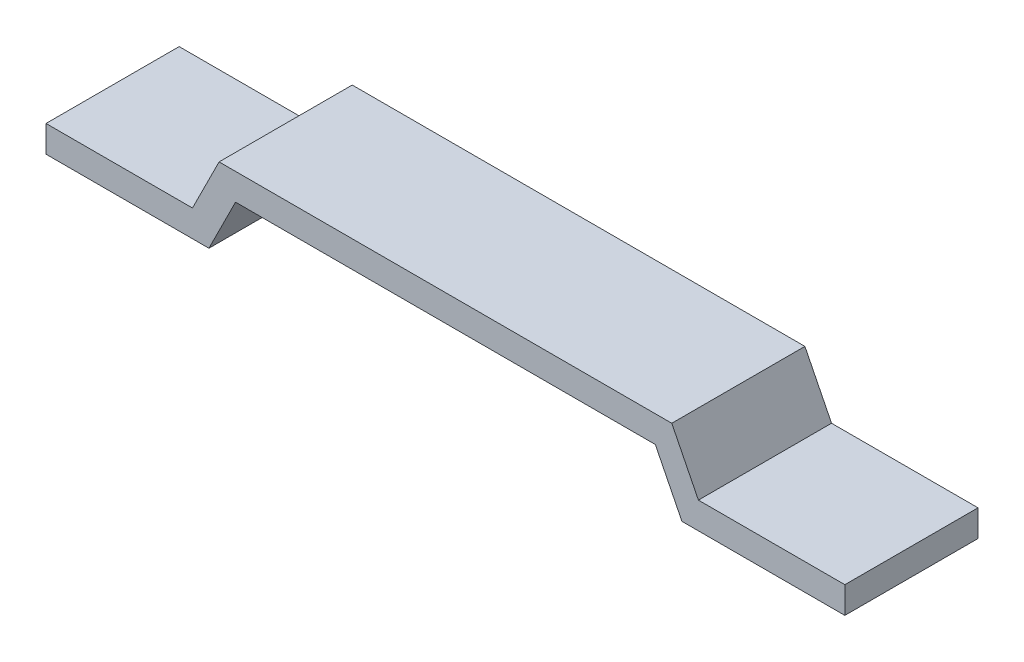
from build123d import *

# Parameters (mm, degrees)
BOSS_EXTRUDE1_DEPTH = 50


with BuildPart() as part:
    # Sketch1 → Boss-Extrude1 (new body)
    with BuildSketch(Plane.XY):
        Polygon((-150, 0), (-150, 10), (-95, 10), (-85, 30), (0, 30), (85, 30), (95, 10), (150, 10), (150, 0), (140, 0), (88.819660113, 0), (78.819660113, 20), (0, 20), (-78.819660113, 20), (-88.819660113, 0), (-140, 0), align=None)
    extrude(amount=BOSS_EXTRUDE1_DEPTH)


solid = part.part
